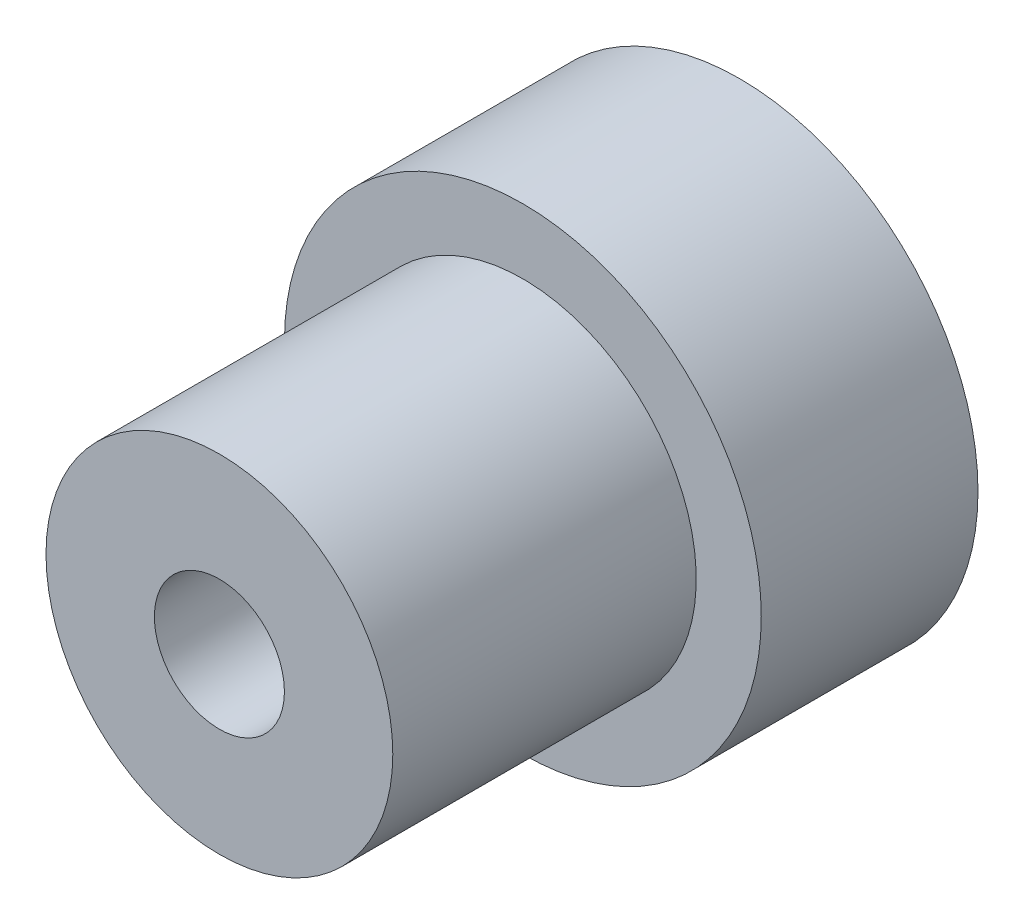
from build123d import *

# Parameters (mm, degrees)
SKETCH_1_R          = 4
EXTRUDE_1_DEPTH     = 12
SKETCH_2_R          = 5.5
EXTRUDE_2_DEPTH     = 5
SKETCH_3_R          = 4
CUT_EXTRUDE_5_DEPTH = 2
SKETCH_5_R          = 1.5
CUT_EXTRUDE_6_DEPTH = 15.300349646


with BuildPart() as part:
    # 草图1 → 拉伸1 (new body)
    with BuildSketch(Plane.XY):
        Circle(SKETCH_1_R)
    extrude(amount=EXTRUDE_1_DEPTH)

    # 草图2 → 拉伸2 (add)
    with BuildSketch(Plane(origin=(0, 0, 0), x_dir=(-1, 0, 0), z_dir=(0, 0, -1))):
        Circle(SKETCH_2_R)
    extrude(amount=-EXTRUDE_2_DEPTH)

    # 草图3 → 拉伸5 (cut)
    with BuildSketch(Plane(origin=(0, 0, 0), x_dir=(-1, 0, 0), z_dir=(0, 0, -1))):
        Circle(SKETCH_3_R)
    extrude(amount=-CUT_EXTRUDE_5_DEPTH, mode=Mode.SUBTRACT)

    # 草图5 → 拉伸6 (cut, through all)
    with BuildSketch(Plane.XY.offset(12)):
        Circle(SKETCH_5_R)
    extrude(amount=-CUT_EXTRUDE_6_DEPTH, mode=Mode.SUBTRACT)


solid = part.part
